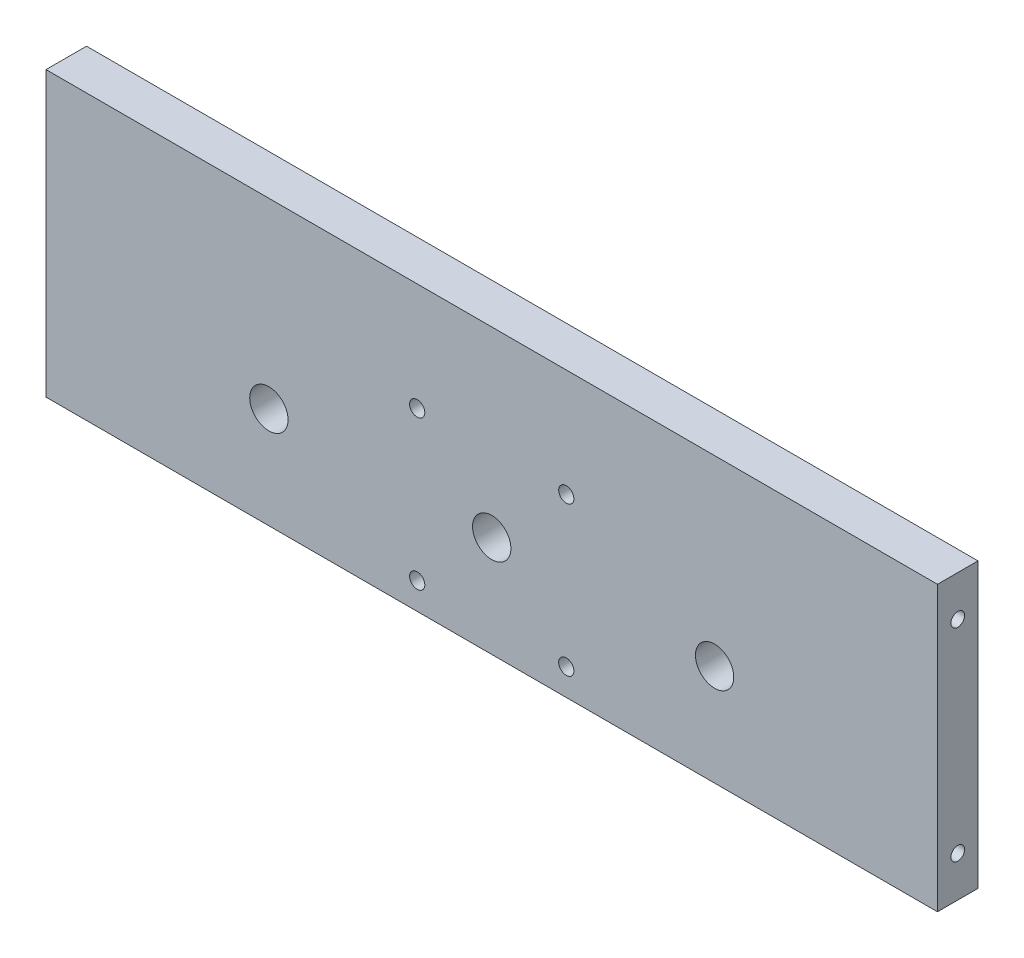
from build123d import *

# Parameters (mm, degrees)
SKETCH1_W           = 279.4
SKETCH1_H           = 88.9
BOSS_EXTRUDE1_DEPTH = 12.7
SKETCH2_R           = 2.1463
CUT_EXTRUDE1_DEPTH  = 38.1
CUT_EXTRUDE2_START  = -38.1
SKETCH3_R           = 2.1463
CUT_EXTRUDE2_DEPTH  = 38.1
SKETCH4_R           = 6.0071
CUT_EXTRUDE3_DEPTH  = 294.477188211
SKETCH5_R           = 2.38125
CUT_EXTRUDE4_DEPTH  = 294.477188211


with BuildPart() as part:
    # Sketch1 → Boss-Extrude1 (new body)
    with BuildSketch(Plane.XY):
        with Locations((139.7, 44.45)):
            Rectangle(SKETCH1_W, SKETCH1_H)
    extrude(amount=BOSS_EXTRUDE1_DEPTH)

    # Sketch2 → Cut-Extrude1 (cut)
    with BuildSketch(Plane(origin=(279.4, 0, 0), x_dir=(0, 0, -1), z_dir=(1, 0, 0))):
        with Locations((-6.35, 76.2)):
            Circle(SKETCH2_R)
        with Locations((-6.35, 12.7)):
            Circle(SKETCH2_R)
    extrude(amount=-CUT_EXTRUDE1_DEPTH, mode=Mode.SUBTRACT)

    # Sketch3 → Cut-Extrude2 (cut)
    with BuildSketch(Plane.ZY.offset(CUT_EXTRUDE2_START)):
        with Locations(Location((6.35, 76.2, 0), (0, 0, 180))):
            Circle(SKETCH3_R)
        with Locations(Location((6.35, 12.7, 0), (0, 0, 180))):
            Circle(SKETCH3_R)
    extrude(amount=CUT_EXTRUDE2_DEPTH, mode=Mode.SUBTRACT)

    # Sketch4 → Cut-Extrude3 (cut, through all)
    with BuildSketch(Plane(origin=(0, 0, 0), x_dir=(-1, 0, 0), z_dir=(0, 0, -1))):
        with Locations((-209.55, 31.75)):
            Circle(SKETCH4_R)
        with Locations((-139.7, 31.75)):
            Circle(SKETCH4_R)
        with Locations((-69.85, 31.75)):
            Circle(SKETCH4_R)
    extrude(amount=-CUT_EXTRUDE3_DEPTH, mode=Mode.SUBTRACT)

    # Sketch5 → Cut-Extrude4 (cut, through all)
    with BuildSketch(Plane.XY):
        with Locations((163.06165, 55.11165)):
            Circle(SKETCH5_R)
        with Locations((116.33835, 55.11165)):
            Circle(SKETCH5_R)
        with Locations((116.33835, 8.38835)):
            Circle(SKETCH5_R)
        with Locations((163.06165, 8.38835)):
            Circle(SKETCH5_R)
    extrude(amount=CUT_EXTRUDE4_DEPTH, mode=Mode.SUBTRACT)


solid = part.part
